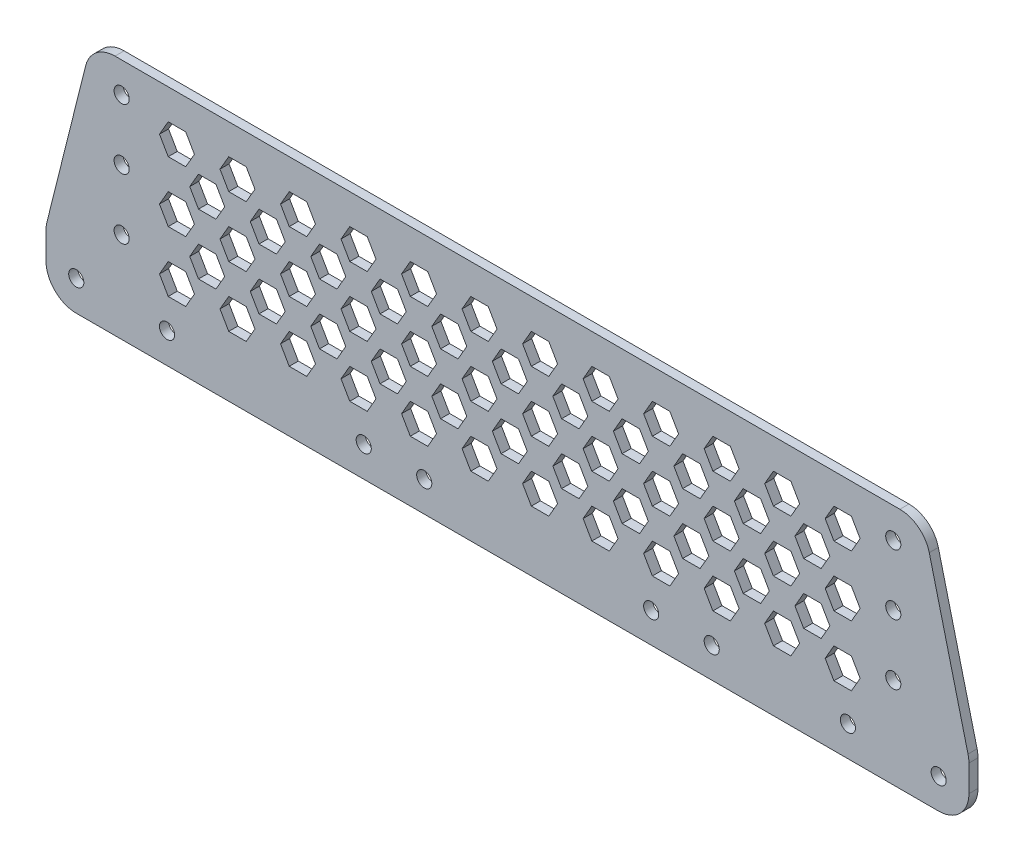
from build123d import *

# Parameters (mm, degrees)
BOSS_EXTRUDE1_DEPTH     = 3
CUT_EXTRUDE2_DEPTH      = 3
LPATTERN1_COUNT         = 12
LPATTERN1_PITCH         = 20
CUT_EXTRUDE3_DEPTH      = 3
LPATTERN2_COUNT         = 11
LPATTERN2_PITCH         = 20
CUT_EXTRUDE4_DEPTH      = 3
LPATTERN3_COUNT         = 12
LPATTERN3_PITCH         = 20
LPATTERN4_COUNT         = 2
LPATTERN4_PITCH         = 20
LPATTERN4_COPY_1_DEPTH  = 3
LPATTERN4_COPY_2_DEPTH  = 3
LPATTERN4_COPY_3_DEPTH  = 3
LPATTERN4_COPY_4_DEPTH  = 3
LPATTERN4_COPY_5_DEPTH  = 3
LPATTERN4_COPY_6_DEPTH  = 3
LPATTERN4_COPY_7_DEPTH  = 3
LPATTERN4_COPY_8_DEPTH  = 3
LPATTERN4_COPY_9_DEPTH  = 3
LPATTERN4_COPY_10_DEPTH = 3
LPATTERN4_COPY_11_DEPTH = 3
LPATTERN4_COPY_12_DEPTH = 3
LPATTERN4_COPY_13_DEPTH = 3
LPATTERN4_COPY_14_DEPTH = 3
LPATTERN4_COPY_15_DEPTH = 3
LPATTERN4_COPY_16_DEPTH = 3
LPATTERN4_COPY_17_DEPTH = 3
LPATTERN4_COPY_18_DEPTH = 3
LPATTERN4_COPY_19_DEPTH = 3
LPATTERN4_COPY_20_DEPTH = 3
LPATTERN4_COPY_21_DEPTH = 3
SKETCH7_R               = 2.5
CUT_EXTRUDE5_DEPTH      = 3
FILLET1_R               = 10


with BuildPart() as part:
    # Sketch1 → Boss-Extrude1 (new body)
    with BuildSketch(Plane.XY):
        Polygon((0, 0), (-15, 0), (-15, 20), (0, 80), (275, 80), (290, 20), (290, 0), (275, 0), align=None)
    extrude(amount=BOSS_EXTRUDE1_DEPTH)

    # Sketch3 → Cut-Extrude2 (cut)
    with BuildSketch(Plane.XY.offset(3)):
        Polygon((34.047005384, 65), (31.160254038, 70), (25.386751346, 70), (22.5, 65), (25.386751346, 60), (31.160254038, 60), align=None)
    cut_extrude2 = extrude(amount=-CUT_EXTRUDE2_DEPTH, mode=Mode.SUBTRACT)

    # LPattern1: Cut-Extrude2 ×12
    with Locations(*[(i * LPATTERN1_PITCH, 0, 0) for i in range(1, LPATTERN1_COUNT)]):
        add(cut_extrude2, mode=Mode.SUBTRACT)

    # Sketch5 → Cut-Extrude3 (cut)
    with BuildSketch(Plane.XY.offset(3)):
        Polygon((32.5, 55), (35.386751346, 50), (41.160254038, 50), (44.047005384, 55), (41.160254038, 60), (35.386751346, 60), align=None)
    cut_extrude3 = extrude(amount=-CUT_EXTRUDE3_DEPTH, mode=Mode.SUBTRACT)

    # LPattern2: Cut-Extrude3 ×11
    with Locations(*[(i * LPATTERN2_PITCH, 0, 0) for i in range(1, LPATTERN2_COUNT)]):
        add(cut_extrude3, mode=Mode.SUBTRACT)

    # Sketch6 → Cut-Extrude4 (cut)
    with BuildSketch(Plane.XY.offset(3)):
        Polygon((34.047005384, 45), (31.160254038, 50), (25.386751346, 50), (22.5, 45), (25.386751346, 40), (31.160254038, 40), align=None)
    cut_extrude4 = extrude(amount=-CUT_EXTRUDE4_DEPTH, mode=Mode.SUBTRACT)

    # LPattern3: Cut-Extrude4 ×12
    with Locations(*[(i * LPATTERN3_PITCH, 0, 0) for i in range(1, LPATTERN3_COUNT)]):
        add(cut_extrude4, mode=Mode.SUBTRACT)

    # LPattern4: Cut-Extrude3, Cut-Extrude4 ×2
    with Locations(*[(0, -i * LPATTERN4_PITCH, 0) for i in range(1, LPATTERN4_COUNT)]):
        add(cut_extrude3, mode=Mode.SUBTRACT)
        add(cut_extrude4, mode=Mode.SUBTRACT)

    # LPattern4 copy 1 sketch → LPattern4 copy 1 (cut)
    with BuildSketch(Plane(origin=(20, -20, 3), x_dir=(1, 0, 0), z_dir=(0, 0, 1))):
        Polygon((32.5, 55), (35.386751346, 50), (41.160254038, 50), (44.047005384, 55), (41.160254038, 60), (35.386751346, 60), align=None)
    extrude(amount=-LPATTERN4_COPY_1_DEPTH, mode=Mode.SUBTRACT)

    # LPattern4 copy 2 sketch → LPattern4 copy 2 (cut)
    with BuildSketch(Plane(origin=(40, -20, 3), x_dir=(1, 0, 0), z_dir=(0, 0, 1))):
        Polygon((32.5, 55), (35.386751346, 50), (41.160254038, 50), (44.047005384, 55), (41.160254038, 60), (35.386751346, 60), align=None)
    extrude(amount=-LPATTERN4_COPY_2_DEPTH, mode=Mode.SUBTRACT)

    # LPattern4 copy 3 sketch → LPattern4 copy 3 (cut)
    with BuildSketch(Plane(origin=(60, -20, 3), x_dir=(1, 0, 0), z_dir=(0, 0, 1))):
        Polygon((32.5, 55), (35.386751346, 50), (41.160254038, 50), (44.047005384, 55), (41.160254038, 60), (35.386751346, 60), align=None)
    extrude(amount=-LPATTERN4_COPY_3_DEPTH, mode=Mode.SUBTRACT)

    # LPattern4 copy 4 sketch → LPattern4 copy 4 (cut)
    with BuildSketch(Plane(origin=(80, -20, 3), x_dir=(1, 0, 0), z_dir=(0, 0, 1))):
        Polygon((32.5, 55), (35.386751346, 50), (41.160254038, 50), (44.047005384, 55), (41.160254038, 60), (35.386751346, 60), align=None)
    extrude(amount=-LPATTERN4_COPY_4_DEPTH, mode=Mode.SUBTRACT)

    # LPattern4 copy 5 sketch → LPattern4 copy 5 (cut)
    with BuildSketch(Plane(origin=(100, -20, 3), x_dir=(1, 0, 0), z_dir=(0, 0, 1))):
        Polygon((32.5, 55), (35.386751346, 50), (41.160254038, 50), (44.047005384, 55), (41.160254038, 60), (35.386751346, 60), align=None)
    extrude(amount=-LPATTERN4_COPY_5_DEPTH, mode=Mode.SUBTRACT)

    # LPattern4 copy 6 sketch → LPattern4 copy 6 (cut)
    with BuildSketch(Plane(origin=(120, -20, 3), x_dir=(1, 0, 0), z_dir=(0, 0, 1))):
        Polygon((32.5, 55), (35.386751346, 50), (41.160254038, 50), (44.047005384, 55), (41.160254038, 60), (35.386751346, 60), align=None)
    extrude(amount=-LPATTERN4_COPY_6_DEPTH, mode=Mode.SUBTRACT)

    # LPattern4 copy 7 sketch → LPattern4 copy 7 (cut)
    with BuildSketch(Plane(origin=(140, -20, 3), x_dir=(1, 0, 0), z_dir=(0, 0, 1))):
        Polygon((32.5, 55), (35.386751346, 50), (41.160254038, 50), (44.047005384, 55), (41.160254038, 60), (35.386751346, 60), align=None)
    extrude(amount=-LPATTERN4_COPY_7_DEPTH, mode=Mode.SUBTRACT)

    # LPattern4 copy 8 sketch → LPattern4 copy 8 (cut)
    with BuildSketch(Plane(origin=(160, -20, 3), x_dir=(1, 0, 0), z_dir=(0, 0, 1))):
        Polygon((32.5, 55), (35.386751346, 50), (41.160254038, 50), (44.047005384, 55), (41.160254038, 60), (35.386751346, 60), align=None)
    extrude(amount=-LPATTERN4_COPY_8_DEPTH, mode=Mode.SUBTRACT)

    # LPattern4 copy 9 sketch → LPattern4 copy 9 (cut)
    with BuildSketch(Plane(origin=(180, -20, 3), x_dir=(1, 0, 0), z_dir=(0, 0, 1))):
        Polygon((32.5, 55), (35.386751346, 50), (41.160254038, 50), (44.047005384, 55), (41.160254038, 60), (35.386751346, 60), align=None)
    extrude(amount=-LPATTERN4_COPY_9_DEPTH, mode=Mode.SUBTRACT)

    # LPattern4 copy 10 sketch → LPattern4 copy 10 (cut)
    with BuildSketch(Plane(origin=(200, -20, 3), x_dir=(1, 0, 0), z_dir=(0, 0, 1))):
        Polygon((32.5, 55), (35.386751346, 50), (41.160254038, 50), (44.047005384, 55), (41.160254038, 60), (35.386751346, 60), align=None)
    extrude(amount=-LPATTERN4_COPY_10_DEPTH, mode=Mode.SUBTRACT)

    # LPattern4 copy 11 sketch → LPattern4 copy 11 (cut)
    with BuildSketch(Plane(origin=(20, -20, 3), x_dir=(1, 0, 0), z_dir=(0, 0, 1))):
        Polygon((34.047005384, 45), (31.160254038, 50), (25.386751346, 50), (22.5, 45), (25.386751346, 40), (31.160254038, 40), align=None)
    extrude(amount=-LPATTERN4_COPY_11_DEPTH, mode=Mode.SUBTRACT)

    # LPattern4 copy 12 sketch → LPattern4 copy 12 (cut)
    with BuildSketch(Plane(origin=(40, -20, 3), x_dir=(1, 0, 0), z_dir=(0, 0, 1))):
        Polygon((34.047005384, 45), (31.160254038, 50), (25.386751346, 50), (22.5, 45), (25.386751346, 40), (31.160254038, 40), align=None)
    extrude(amount=-LPATTERN4_COPY_12_DEPTH, mode=Mode.SUBTRACT)

    # LPattern4 copy 13 sketch → LPattern4 copy 13 (cut)
    with BuildSketch(Plane(origin=(60, -20, 3), x_dir=(1, 0, 0), z_dir=(0, 0, 1))):
        Polygon((34.047005384, 45), (31.160254038, 50), (25.386751346, 50), (22.5, 45), (25.386751346, 40), (31.160254038, 40), align=None)
    extrude(amount=-LPATTERN4_COPY_13_DEPTH, mode=Mode.SUBTRACT)

    # LPattern4 copy 14 sketch → LPattern4 copy 14 (cut)
    with BuildSketch(Plane(origin=(80, -20, 3), x_dir=(1, 0, 0), z_dir=(0, 0, 1))):
        Polygon((34.047005384, 45), (31.160254038, 50), (25.386751346, 50), (22.5, 45), (25.386751346, 40), (31.160254038, 40), align=None)
    extrude(amount=-LPATTERN4_COPY_14_DEPTH, mode=Mode.SUBTRACT)

    # LPattern4 copy 15 sketch → LPattern4 copy 15 (cut)
    with BuildSketch(Plane(origin=(100, -20, 3), x_dir=(1, 0, 0), z_dir=(0, 0, 1))):
        Polygon((34.047005384, 45), (31.160254038, 50), (25.386751346, 50), (22.5, 45), (25.386751346, 40), (31.160254038, 40), align=None)
    extrude(amount=-LPATTERN4_COPY_15_DEPTH, mode=Mode.SUBTRACT)

    # LPattern4 copy 16 sketch → LPattern4 copy 16 (cut)
    with BuildSketch(Plane(origin=(120, -20, 3), x_dir=(1, 0, 0), z_dir=(0, 0, 1))):
        Polygon((34.047005384, 45), (31.160254038, 50), (25.386751346, 50), (22.5, 45), (25.386751346, 40), (31.160254038, 40), align=None)
    extrude(amount=-LPATTERN4_COPY_16_DEPTH, mode=Mode.SUBTRACT)

    # LPattern4 copy 17 sketch → LPattern4 copy 17 (cut)
    with BuildSketch(Plane(origin=(140, -20, 3), x_dir=(1, 0, 0), z_dir=(0, 0, 1))):
        Polygon((34.047005384, 45), (31.160254038, 50), (25.386751346, 50), (22.5, 45), (25.386751346, 40), (31.160254038, 40), align=None)
    extrude(amount=-LPATTERN4_COPY_17_DEPTH, mode=Mode.SUBTRACT)

    # LPattern4 copy 18 sketch → LPattern4 copy 18 (cut)
    with BuildSketch(Plane(origin=(160, -20, 3), x_dir=(1, 0, 0), z_dir=(0, 0, 1))):
        Polygon((34.047005384, 45), (31.160254038, 50), (25.386751346, 50), (22.5, 45), (25.386751346, 40), (31.160254038, 40), align=None)
    extrude(amount=-LPATTERN4_COPY_18_DEPTH, mode=Mode.SUBTRACT)

    # LPattern4 copy 19 sketch → LPattern4 copy 19 (cut)
    with BuildSketch(Plane(origin=(180, -20, 3), x_dir=(1, 0, 0), z_dir=(0, 0, 1))):
        Polygon((34.047005384, 45), (31.160254038, 50), (25.386751346, 50), (22.5, 45), (25.386751346, 40), (31.160254038, 40), align=None)
    extrude(amount=-LPATTERN4_COPY_19_DEPTH, mode=Mode.SUBTRACT)

    # LPattern4 copy 20 sketch → LPattern4 copy 20 (cut)
    with BuildSketch(Plane(origin=(200, -20, 3), x_dir=(1, 0, 0), z_dir=(0, 0, 1))):
        Polygon((34.047005384, 45), (31.160254038, 50), (25.386751346, 50), (22.5, 45), (25.386751346, 40), (31.160254038, 40), align=None)
    extrude(amount=-LPATTERN4_COPY_20_DEPTH, mode=Mode.SUBTRACT)

    # LPattern4 copy 21 sketch → LPattern4 copy 21 (cut)
    with BuildSketch(Plane(origin=(220, -20, 3), x_dir=(1, 0, 0), z_dir=(0, 0, 1))):
        Polygon((34.047005384, 45), (31.160254038, 50), (25.386751346, 50), (22.5, 45), (25.386751346, 40), (31.160254038, 40), align=None)
    extrude(amount=-LPATTERN4_COPY_21_DEPTH, mode=Mode.SUBTRACT)

    # Sketch7 → Cut-Extrude5 (cut)
    with BuildSketch(Plane(origin=(0, 0, 0), x_dir=(-1, 0, 0), z_dir=(0, 0, -1))):
        with Locations((-10, 70)):
            Circle(SKETCH7_R)
        with Locations((-10, 50)):
            Circle(SKETCH7_R)
        with Locations((-10, 30)):
            Circle(SKETCH7_R)
        with Locations(Location((-265, 30, 0), (0, 0, 180))):
            Circle(SKETCH7_R)
        with Locations(Location((-265, 50, 0), (0, 0, 180))):
            Circle(SKETCH7_R)
        with Locations(Location((-265, 70, 0), (0, 0, 180))):
            Circle(SKETCH7_R)
        with Locations((-110, 10)):
            Circle(SKETCH7_R)
        with Locations((-25, 10)):
            Circle(SKETCH7_R)
        with Locations(Location((-250, 10, 0), (0, 0, 180))):
            Circle(SKETCH7_R)
        with Locations((-90, 10)):
            Circle(SKETCH7_R)
        with Locations((-185, 10)):
            Circle(SKETCH7_R)
        with Locations((-205, 10)):
            Circle(SKETCH7_R)
        with Locations((-280, 10)):
            Circle(SKETCH7_R)
        with Locations(Location((5, 10, 0), (0, 0, 180))):
            Circle(SKETCH7_R)
    extrude(amount=-CUT_EXTRUDE5_DEPTH, mode=Mode.SUBTRACT)

    # Fillet1
    fillet1_edges = [part.edges().sort_by_distance(p)[0] for p in [
        (-15, 0, 1.5),
        (-15, 20, 1.5),
        (0, 80, 1.5),
        (275, 80, 1.5),
        (290, 20, 1.5),
        (290, 0, 1.5),
    ]]
    fillet(fillet1_edges, radius=FILLET1_R)


solid = part.part
